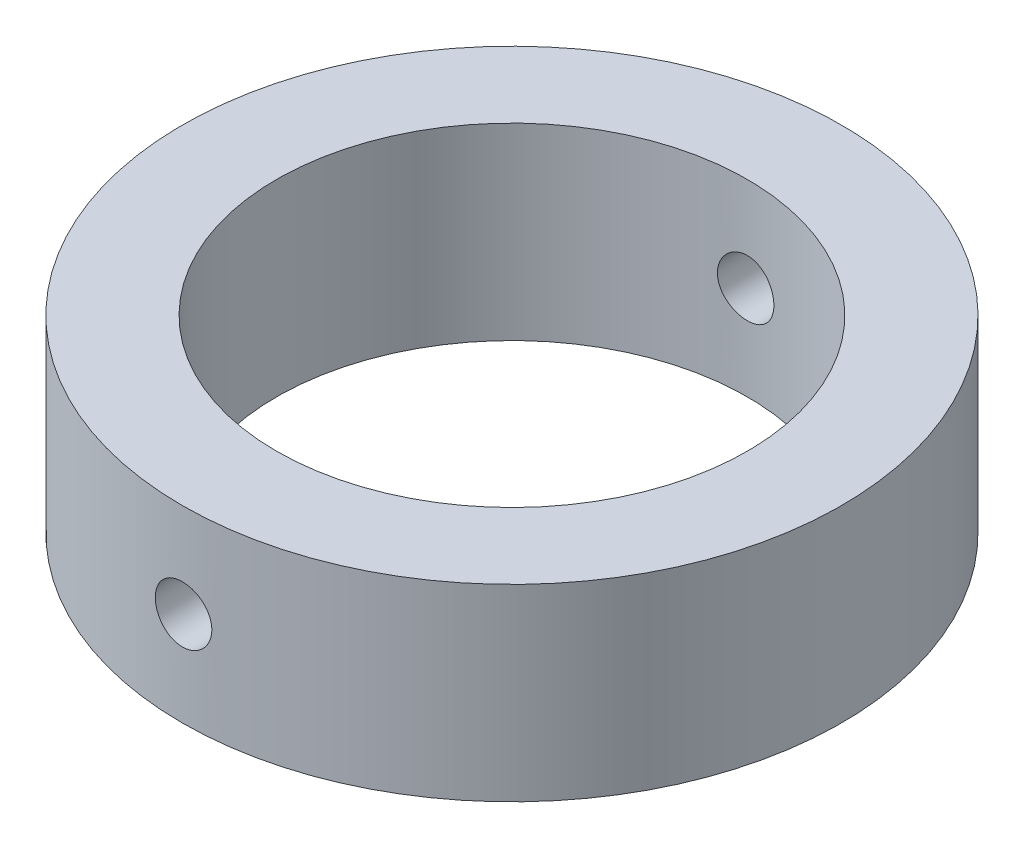
from build123d import *

# Parameters (mm, degrees)
SKETCH1_R               = 35
SKETCH1_R_2             = 25
BOSS_EXTRUDE1_DEPTH     = 20
CUT_EXTRUDE3_DEPTH      = 54.38539126
CUT_EXTRUDE3_DEPTH_BACK = 54.38539126
SKETCH2_R               = 3


with BuildPart() as part:
    # Sketch1 → Boss-Extrude1 (new body)
    with BuildSketch(Plane(origin=(0, 0, 0), x_dir=(1, 0, 0), z_dir=(0, 1, 0))):
        with Locations(Location((0, 0, 0), (0, 0, 270))):
            Circle(SKETCH1_R)
        with Locations(Location((0, 0, 0), (0, 0, 270))):
            Circle(SKETCH1_R_2, mode=Mode.SUBTRACT)
    extrude(amount=BOSS_EXTRUDE1_DEPTH)

    # Sketch2 → Cut-Extrude3 (cut, two sides: drawn at the far end of the back side and taken through both)
    with BuildSketch(Plane.XY.offset(-CUT_EXTRUDE3_DEPTH_BACK)):
        with Locations((0, 10)):
            Circle(SKETCH2_R)
    extrude(amount=CUT_EXTRUDE3_DEPTH + CUT_EXTRUDE3_DEPTH_BACK, mode=Mode.SUBTRACT)


solid = part.part
